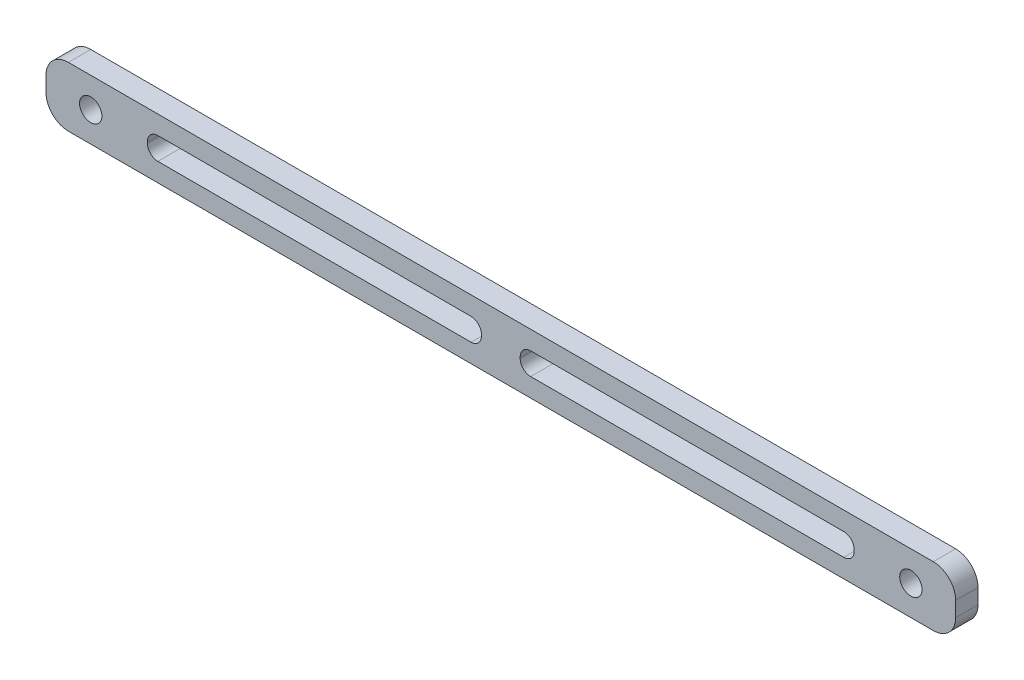
from build123d import *

# Parameters (mm, degrees)
SKETCH1_R           = 1.5
BOSS_EXTRUDE1_DEPTH = 3


with BuildPart() as part:
    # Sketch1 → Boss-Extrude1 (new body)
    with BuildSketch(Plane.XY):
        with BuildLine():
            Line((-58, 4), (58, 4))
            ThreePointArc((58, 4), (60.121320344, 3.121320344), (61, 1))
            Line((61, 1), (61, -1))
            ThreePointArc((61, -1), (60.121320344, -3.121320344), (58, -4))
            Line((58, -4), (-58, -4))
            ThreePointArc((-58, -4), (-60.121320344, -3.121320344), (-61, -1))
            Line((-61, -1), (-61, 1))
            ThreePointArc((-61, 1), (-60.121320344, 3.121320344), (-58, 4))
        make_face()
        with Locations((-55, 0)):
            Circle(SKETCH1_R, mode=Mode.SUBTRACT)
        with Locations((55, 0)):
            Circle(SKETCH1_R, mode=Mode.SUBTRACT)
        with BuildLine():
            Line((-46, 1.5), (-4, 1.5))
            ThreePointArc((-4, 1.5), (-3.010050506, 1.089949494), (-2.6, 0.1))
            Line((-2.6, 0.1), (-2.6, -0.1))
            ThreePointArc((-2.6, -0.1), (-3.010050506, -1.089949494), (-4, -1.5))
            Line((-4, -1.5), (-46, -1.5))
            ThreePointArc((-46, -1.5), (-46.989949494, -1.089949494), (-47.4, -0.1))
            Line((-47.4, -0.1), (-47.4, 0.1))
            ThreePointArc((-47.4, 0.1), (-46.989949494, 1.089949494), (-46, 1.5))
        make_face(mode=Mode.SUBTRACT)
        with BuildLine():
            Line((4, 1.494330249), (46, 1.494330249))
            ThreePointArc((46, 1.494330249), (46.989949494, 1.084279743), (47.4, 0.094330249))
            Line((47.4, 0.094330249), (47.4, -0.094330249))
            ThreePointArc((47.4, -0.094330249), (46.989949494, -1.084279743), (46, -1.494330249))
            Line((46, -1.494330249), (4, -1.494330249))
            ThreePointArc((4, -1.494330249), (3.010050506, -1.084279743), (2.6, -0.094330249))
            Line((2.6, -0.094330249), (2.6, 0.094330249))
            ThreePointArc((2.6, 0.094330249), (3.010050506, 1.084279743), (4, 1.494330249))
        make_face(mode=Mode.SUBTRACT)
    extrude(amount=BOSS_EXTRUDE1_DEPTH)


solid = part.part
